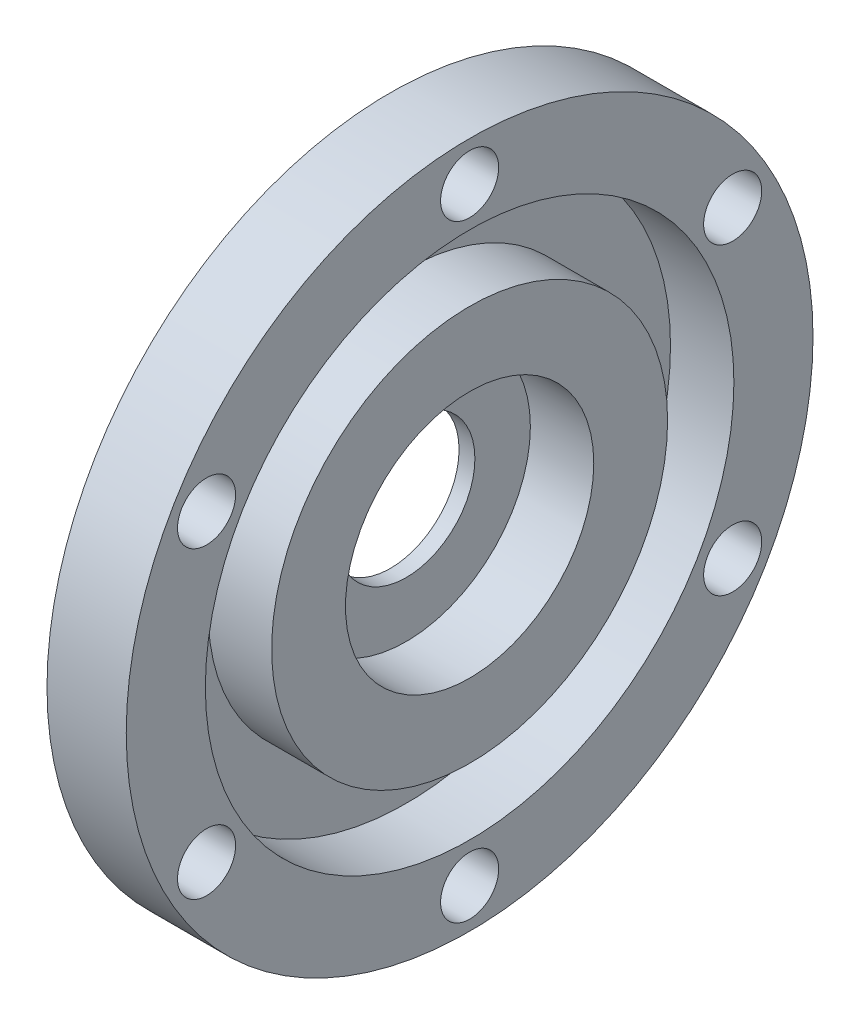
from build123d import *

# Parameters (mm, degrees)
SKETCH1_R                     = 65
SKETCH1_R_2                   = 13
SKETCH1_R_3                   = 2.5
LAYER_EXTRUDE_DEPTH           = 3
SKETCH1_3_R                   = 65
SKETCH1_3_R_2                 = 2.5
SKETCH1_3_R_3                 = 50.025
SKETCH1_3_R_4                 = 37.475
SKETCH1_3_R_5                 = 23.5
BEARING_SUPPORT_EXTRUDE_DEPTH = 15
SKETCH2_R                     = 5.5
CUT_EXTRUDE1_DEPTH            = 8


with BuildPart() as part:
    # Sketch1 → layer_extrude (new body)
    with BuildSketch(Plane(origin=(0, 0, 0), x_dir=(0, 0, -1), z_dir=(1, 0, 0))):
        Circle(SKETCH1_R)
        Circle(SKETCH1_R_2, mode=Mode.SUBTRACT)
        with Locations((-49.796460718, -28.75)):
            Circle(SKETCH1_R_3, mode=Mode.SUBTRACT)
        with Locations((0, -57.5)):
            Circle(SKETCH1_R_3, mode=Mode.SUBTRACT)
        with Locations((49.796460718, -28.75)):
            Circle(SKETCH1_R_3, mode=Mode.SUBTRACT)
        with Locations((-49.796460718, 28.75)):
            Circle(SKETCH1_R_3, mode=Mode.SUBTRACT)
        with Locations((0, 57.5)):
            Circle(SKETCH1_R_3, mode=Mode.SUBTRACT)
        with Locations((49.796460718, 28.75)):
            Circle(SKETCH1_R_3, mode=Mode.SUBTRACT)
    extrude(amount=LAYER_EXTRUDE_DEPTH)

    # Sketch1<3> → bearing_support_extrude (add)
    # profile 1 of 2: a face of its own
    with BuildSketch(Plane(origin=(0, 0, 0), x_dir=(0, 0, -1), z_dir=(1, 0, 0))):
        Circle(SKETCH1_3_R)
        with Locations((-49.796460718, -28.75)):
            Circle(SKETCH1_3_R_2, mode=Mode.SUBTRACT)
        with Locations((0, -57.5)):
            Circle(SKETCH1_3_R_2, mode=Mode.SUBTRACT)
        with Locations((49.796460718, -28.75)):
            Circle(SKETCH1_3_R_2, mode=Mode.SUBTRACT)
        with Locations((-49.796460718, 28.75)):
            Circle(SKETCH1_3_R_2, mode=Mode.SUBTRACT)
        Circle(SKETCH1_3_R_3, mode=Mode.SUBTRACT)
        with Locations((49.796460718, 28.75)):
            Circle(SKETCH1_3_R_2, mode=Mode.SUBTRACT)
        with Locations((0, 57.5)):
            Circle(SKETCH1_3_R_2, mode=Mode.SUBTRACT)
    # profile 2 of 2: a face of its own
    with BuildSketch(Plane(origin=(0, 0, 0), x_dir=(0, 0, -1), z_dir=(1, 0, 0))):
        Circle(SKETCH1_3_R_4)
        Circle(SKETCH1_3_R_5, mode=Mode.SUBTRACT)
    extrude(amount=BEARING_SUPPORT_EXTRUDE_DEPTH)

    # Sketch2 → Cut-Extrude1 (cut)
    with BuildSketch(Plane(origin=(15, 0, 0), x_dir=(0, 0, -1), z_dir=(1, 0, 0))):
        with Locations((0, 57.5)):
            Circle(SKETCH2_R)
        with Locations((49.796460718, 28.75)):
            Circle(SKETCH2_R)
        with Locations((49.796460718, -28.75)):
            Circle(SKETCH2_R)
        with Locations((0, -57.5)):
            Circle(SKETCH2_R)
        with Locations((-49.796460718, -28.75)):
            Circle(SKETCH2_R)
        with Locations((-49.796460718, 28.75)):
            Circle(SKETCH2_R)
    extrude(amount=-CUT_EXTRUDE1_DEPTH, mode=Mode.SUBTRACT)


solid = part.part
